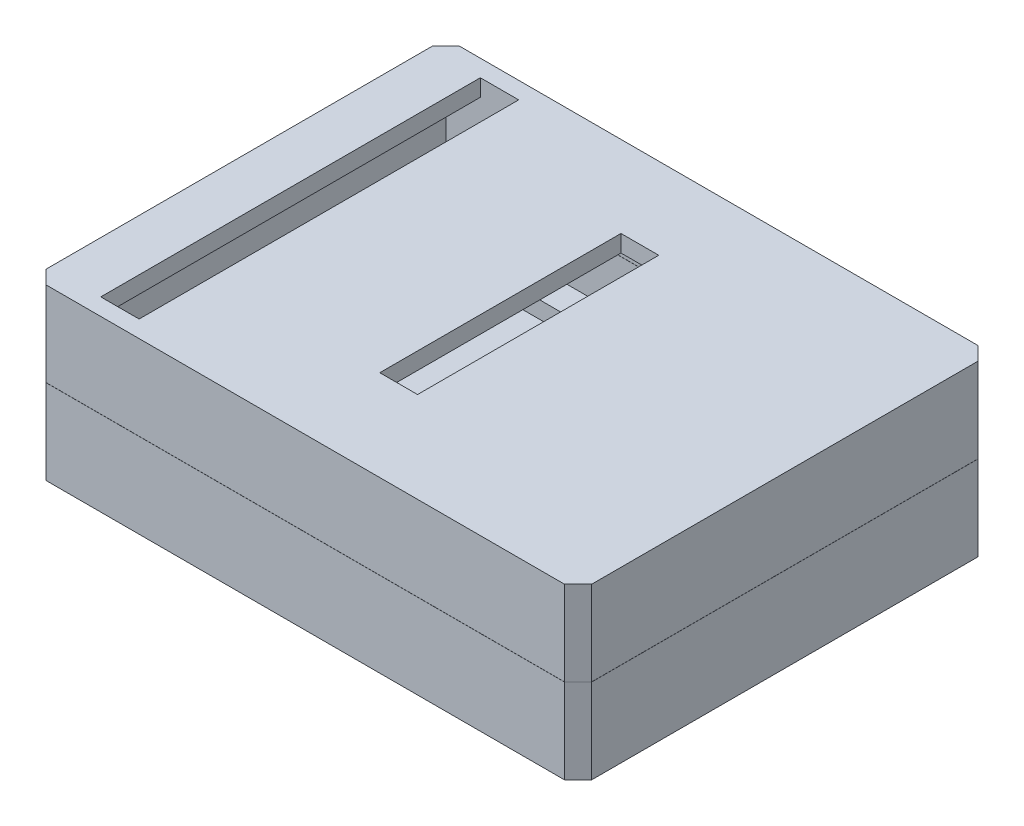
from build123d import *

# Parameters (mm, degrees)
SKETCH1_W           = 102.235
SKETCH1_H           = 77.47
BOSS_EXTRUDE1_DEPTH = 31.75
SKETCH5_W           = 138.084997612
SKETCH5_H           = 0.0254
CUT_EXTRUDE4_DEPTH  = 99.095169128
SHELL1_T            = -3.175
SHELL2_T            = -3.175
SKETCH6_W           = 95.885
SKETCH6_H           = 71.12
SKETCH6_W_2         = 85.725
SKETCH6_H_2         = 60.96
BOSS_EXTRUDE2_DEPTH = 3.175
SKETCH7_W           = 12.378962441
SKETCH7_H           = 5.08
CUT_EXTRUDE5_DEPTH  = 3.175
SKETCH8_W           = 7.187389466
SKETCH8_H           = 71.12
SKETCH8_W_2         = 7.078489625
SKETCH8_H_2         = 45.193433761
CUT_EXTRUDE6_DEPTH  = 71.2134578
CHAMFER1_SIZE       = 2.54
CHAMFER2_SIZE       = 2.54
SKETCH9_R           = 3.175
CUT_EXTRUDE7_DEPTH  = 71.2134578


with BuildPart() as part:
    # Sketch1 → Boss-Extrude1 (new body)
    with BuildSketch(Plane(origin=(0, 0, 0), x_dir=(1, 0, 0), z_dir=(0, 1, 0))):
        Rectangle(SKETCH1_W, SKETCH1_H)
    extrude(amount=BOSS_EXTRUDE1_DEPTH)

    # Sketch5 → Cut-Extrude4 (cut, through all)
    with BuildSketch(Plane.XY.offset(38.735)):
        with Locations((-1.742397446, 15.8877)):
            Rectangle(SKETCH5_W, SKETCH5_H)
    extrude(amount=-CUT_EXTRUDE4_DEPTH, mode=Mode.SUBTRACT)


with BuildPart() as cut_extrude4_piece_1:
    # of the separate pieces the step leaves, piece 1, a body of its own (cut_extrude4_pieces)
    add(part.part.solids().sort_by_distance((-51.1175, 0, 38.735))[0])

    # Shell1
    shell1_openings = [cut_extrude4_piece_1.faces().sort_by_distance(p)[0] for p in [
        (0, 15.875, 0),
    ]]
    offset(amount=SHELL1_T, openings=shell1_openings, kind=Kind.INTERSECTION)

    # Sketch6 → Boss-Extrude2 (add)
    with BuildSketch(Plane(origin=(0, 3.175, 0), x_dir=(1, 0, 0), z_dir=(0, 1, 0))):
        Rectangle(SKETCH6_W, SKETCH6_H)
        Rectangle(SKETCH6_W_2, SKETCH6_H_2, mode=Mode.SUBTRACT)
    extrude(amount=BOSS_EXTRUDE2_DEPTH)

    # Sketch7 → Cut-Extrude5 (cut)
    with BuildSketch(Plane(origin=(0, 6.35, 0), x_dir=(1, 0, 0), z_dir=(0, 1, 0))):
        with Locations((-36.67301878, 33.02)):
            Rectangle(SKETCH7_W, SKETCH7_H)
        with Locations((-36.67301878, -33.02)):
            Rectangle(SKETCH7_W, SKETCH7_H)
    extrude(amount=-CUT_EXTRUDE5_DEPTH, mode=Mode.SUBTRACT)

    # Chamfer2
    chamfer2_edges = [cut_extrude4_piece_1.edges().sort_by_distance(p)[0] for p in [
        (-51.1175, 7.9375, 38.735),
        (-51.1175, 7.9375, -38.735),
        (51.1175, 7.9375, -38.735),
        (51.1175, 7.9375, 38.735),
    ]]
    chamfer(chamfer2_edges, length=CHAMFER2_SIZE)

    # Sketch9 → Cut-Extrude7 (cut, through all)
    with BuildSketch(Plane(origin=(0, 3.175, 0), x_dir=(1, 0, 0), z_dir=(0, 1, 0))):
        with Locations(Location((-39.6875, 27.305, 0), (0, 0, 270))):
            Circle(SKETCH9_R)
        with Locations(Location((39.6875, 27.305, 0), (0, 0, 270))):
            Circle(SKETCH9_R)
        with Locations(Location((39.6875, -27.305, 0), (0, 0, 270))):
            Circle(SKETCH9_R)
        with Locations(Location((-39.6875, -27.305, 0), (0, 0, 270))):
            Circle(SKETCH9_R)
    extrude(amount=-CUT_EXTRUDE7_DEPTH, mode=Mode.SUBTRACT)


with BuildPart() as cut_extrude4_piece_2:
    # of the separate pieces the step leaves, piece 2, a body of its own (cut_extrude4_pieces)
    add(part.part.solids().sort_by_distance((51.1175, 15.9004, 38.735))[0])

    # Shell2
    shell2_openings = [cut_extrude4_piece_2.faces().sort_by_distance(p)[0] for p in [
        (0, 15.9004, 0),
    ]]
    offset(amount=SHELL2_T, openings=shell2_openings, kind=Kind.INTERSECTION)

    # Sketch8 → Cut-Extrude6 (cut, through all)
    with BuildSketch(Plane.XZ.offset(-28.575)):
        with Locations((-37.897144455, 0)):
            Rectangle(SKETCH8_W, SKETCH8_H)
        with Locations((0.490049281, -0.871198724)):
            Rectangle(SKETCH8_W_2, SKETCH8_H_2)
    extrude(amount=-CUT_EXTRUDE6_DEPTH, mode=Mode.SUBTRACT)

    # Chamfer1
    chamfer1_edges = [cut_extrude4_piece_2.edges().sort_by_distance(p)[0] for p in [
        (-51.1175, 23.8252, 38.735),
        (51.1175, 23.8252, 38.735),
        (51.1175, 23.8252, -38.735),
        (-51.1175, 23.8252, -38.735),
    ]]
    chamfer(chamfer1_edges, length=CHAMFER1_SIZE)


solid = Compound([cut_extrude4_piece_1.part, cut_extrude4_piece_2.part])
